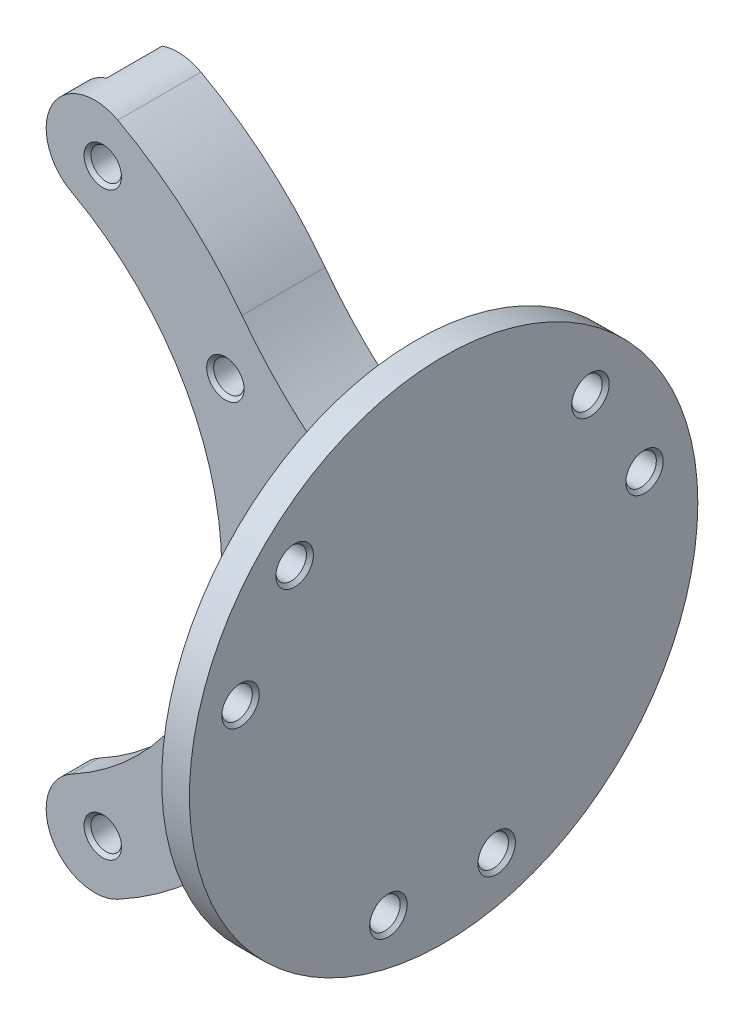
from build123d import *

# Parameters (mm, degrees)
BOSS_EXTRUDE5_DEPTH = 3
BOSS_EXTRUDE6_START = -6
BOSS_EXTRUDE6_DEPTH = 6
CIRPATTERN4_COUNT   = 12
BOSS_EXTRUDE8_START = -9
BOSS_EXTRUDE8_DEPTH = 9
SKETCH25_R          = 27.5
SKETCH25_W          = 9
SKETCH25_H          = 25
BOSS_EXTRUDE9_DEPTH = 3
CIRPATTERN5_COUNT   = 12
FILLET2_R           = 3


with BuildPart() as part:
    # Sketch1 → Boss-Extrude5 (new body)
    with BuildSketch(Plane.XY):
        with BuildLine():
            ThreePointArc((14.753571677, -27.264117862), (12.634850146, -34.380016896), (19.750749181, -36.498738428))
            ThreePointArc((19.750749181, -36.498738428), (41.5, 0), (19.750749181, 36.498738428))
            ThreePointArc((19.750749181, 36.498738428), (12.634850146, 34.380016896), (14.753571677, 27.264117862))
            ThreePointArc((14.753571677, 27.264117862), (31, 0), (14.753571677, -27.264117862))
        make_face()
    extrude(amount=BOSS_EXTRUDE5_DEPTH)

    # Sketch1<7> → Boss-Extrude6 (add)
    with BuildSketch(Plane.XY.offset(BOSS_EXTRUDE6_START)):
        with BuildLine():
            ThreePointArc((40, 0), (33.333983987, -22.109851007), (15.557724422, -36.850470972))
            ThreePointArc((15.557724422, -36.850470972), (17.691016162, -37.113053671), (19.750749181, -36.498738428))
            ThreePointArc((19.750749181, -36.498738428), (35.650428406, -21.243750952), (41.5, 0))
            ThreePointArc((41.5, 0), (35.650428406, 21.243750952), (19.750749181, 36.498738428))
            ThreePointArc((19.750749181, 36.498738428), (17.691016162, 37.113053671), (15.557724422, 36.850470972))
            ThreePointArc((15.557724422, 36.850470972), (33.333983987, 22.109851007), (40, 0))
        make_face()
    extrude(amount=BOSS_EXTRUDE6_DEPTH)

    # Sketch23 → M4x0.7 Tapped Hole4 (revolve, cut)
    with BuildSketch(Plane(origin=(36.25, 0, 3), x_dir=(0, -1, 0), z_dir=(1, 0, 0))):
        Polygon((0, 0), (0, 11.091420021), (1.65, 10.1), (1.65, 0.375), (2.025, 0), align=None)
    m4x0_7_tapped_hole4 = revolve(axis=Axis((36.25, 0, 9.35), (0, 0, -1)), mode=Mode.SUBTRACT)

    # CirPattern4: M4x0.7 Tapped Hole4 ×12 about axis, 7 skipped
    cirpattern4_axis = Axis((0, 0, 0), (0, 0, -1))
    add([m4x0_7_tapped_hole4.rotate(cirpattern4_axis, i * 360 / CIRPATTERN4_COUNT) for i in range(1, CIRPATTERN4_COUNT) if i not in (3, 4, 5, 6, 7, 8, 9)], mode=Mode.SUBTRACT)

    # Sketch15 → Boss-Extrude8 (add)
    with BuildSketch(Plane.XY.offset(3).offset(BOSS_EXTRUDE8_START)):
        with BuildLine():
            Line((47.5, 12.5), (47.5, -12.5))
            ThreePointArc((47.5, -12.5), (39.682119593, -17.947088957), (33.186389126, -24.918137506))
            ThreePointArc((33.186389126, -24.918137506), (41.5, 0), (33.186389126, 24.918137506))
            ThreePointArc((33.186389126, 24.918137506), (39.682119593, 17.947088957), (47.5, 12.5))
        make_face()
    extrude(amount=BOSS_EXTRUDE8_DEPTH)

    # Sketch25 → Boss-Extrude9 (add)
    # profile 1 of 2: a face of its own
    with BuildSketch(Plane(origin=(47.5, 0, 0), x_dir=(0, 0, -1), z_dir=(1, 0, 0))):
        with Locations((1.5, 0)):
            Circle(SKETCH25_R)
        with Locations((1.5, 0)):
            Rectangle(SKETCH25_W, SKETCH25_H, mode=Mode.SUBTRACT)
    # profile 2 of 2: a face of its own
    with BuildSketch(Plane(origin=(47.5, 0, 0), x_dir=(0, 0, -1), z_dir=(1, 0, 0))):
        with Locations((1.5, 0)):
            Rectangle(SKETCH25_W, SKETCH25_H)
    extrude(amount=BOSS_EXTRUDE9_DEPTH)

    # Sketch28 → M4x0.7 Tapped Hole5 (revolve, cut)
    with BuildSketch(Plane(origin=(50.5, 5.823428515, -23.233331092), x_dir=(0, 0, -1), z_dir=(0, 1, 0))):
        Polygon((0, 0), (0, 11.091420021), (1.65, 10.1), (1.65, 0.375), (2.025, 0), align=None)
    m4x0_7_tapped_hole5 = revolve(axis=Axis((56.85, 5.823428515, -23.233331092), (-1, 0, 0)), mode=Mode.SUBTRACT)

    # CirPattern5: M4x0.7 Tapped Hole5 ×12 about axis, 6 skipped
    cirpattern5_axis = Axis((0, -0.031748609, -1.381512577), (1, 0, 0))
    add([m4x0_7_tapped_hole5.rotate(cirpattern5_axis, i * 360 / CIRPATTERN5_COUNT) for i in range(1, CIRPATTERN5_COUNT) if i not in (2, 3, 6, 7, 10, 11)], mode=Mode.SUBTRACT)

    # Fillet2
    fillet2_edges = [part.edges().sort_by_distance(p)[0] for p in [
        (47.5, 0, -6),
        (47.5, 12.5, -1.5),
        (47.5, -12.5, -1.5),
        (47.5, 0, 3),
    ]]
    fillet(fillet2_edges, radius=FILLET2_R)


solid = part.part
